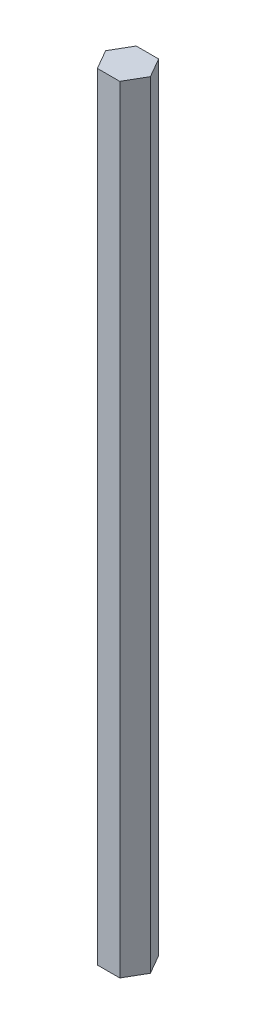
from build123d import *

# Parameters (mm, degrees)
BOSS_EXTRUDE1_DEPTH = 254


with BuildPart() as part:
    # Sketch2 → Boss-Extrude1 (new body)
    with BuildSketch(Plane(origin=(0, 0, 0), x_dir=(1, 0, 0), z_dir=(0, 1, 0))):
        Polygon((7.332348419, 0), (3.666174209, 6.35), (-3.666174209, 6.35), (-7.332348419, 0), (-3.666174209, -6.35), (3.666174209, -6.35), align=None)
    extrude(amount=BOSS_EXTRUDE1_DEPTH)


solid = part.part
